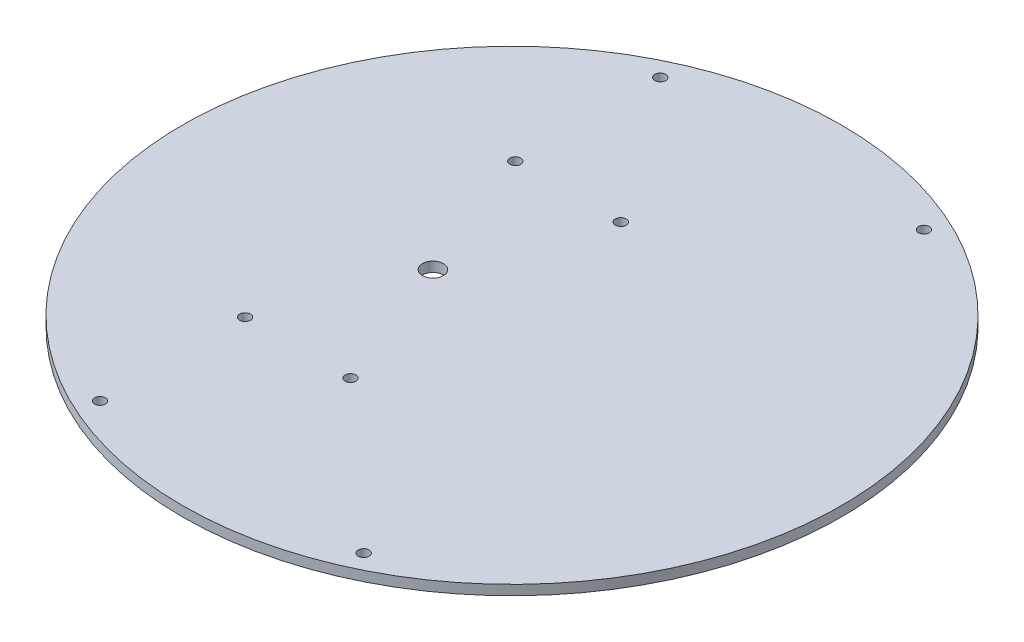
from build123d import *

# Parameters (mm, degrees)
CROQUIS1_R              = 100
CROQUIS1_R_2            = 1.65
CROQUIS1_R_3            = 3.175
SALIENTE_EXTRUIR1_DEPTH = 3


with BuildPart() as part:
    # Croquis1 → Saliente-Extruir1 (new body)
    with BuildSketch(Plane(origin=(0, 0, 0), x_dir=(1, 0, 0), z_dir=(0, 1, 0))):
        with Locations(Location((0, 0, 0), (0, 0, 270))):
            Circle(CROQUIS1_R)
        with Locations(Location((40, -85, 0), (0, 0, 270))):
            Circle(CROQUIS1_R_2, mode=Mode.SUBTRACT)
        with Locations(Location((40, 85, 0), (0, 0, 90))):
            Circle(CROQUIS1_R_2, mode=Mode.SUBTRACT)
        with Locations(Location((-40, -85, 0), (0, 0, 90))):
            Circle(CROQUIS1_R_2, mode=Mode.SUBTRACT)
        with Locations(Location((-40, 85, 0), (0, 0, 270))):
            Circle(CROQUIS1_R_2, mode=Mode.SUBTRACT)
        with Locations(Location((-40, 41, 0), (0, 0, 270))):
            Circle(CROQUIS1_R_2, mode=Mode.SUBTRACT)
        with Locations(Location((-40, -41, 0), (0, 0, 270))):
            Circle(CROQUIS1_R_2, mode=Mode.SUBTRACT)
        with Locations(Location((-24, 0, 0), (0, 0, 270))):
            Circle(CROQUIS1_R_3, mode=Mode.SUBTRACT)
        with Locations(Location((-8, 41, 0), (0, 0, 270))):
            Circle(CROQUIS1_R_2, mode=Mode.SUBTRACT)
        with Locations(Location((-8, -41, 0), (0, 0, 270))):
            Circle(CROQUIS1_R_2, mode=Mode.SUBTRACT)
    extrude(amount=SALIENTE_EXTRUIR1_DEPTH)


solid = part.part
